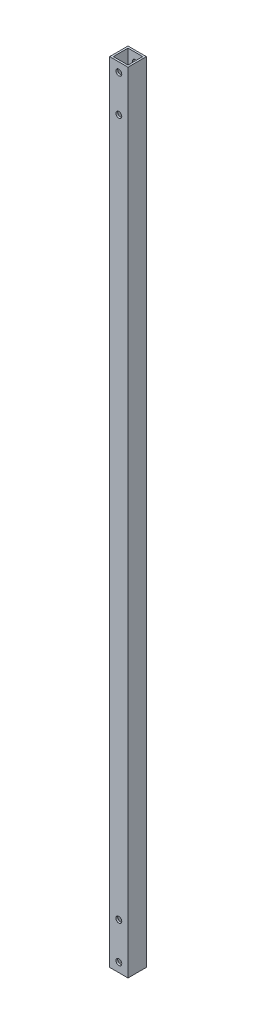
from build123d import *

# Parameters (mm, degrees)
SKETCH_1_W          = 10
SKETCH_1_H          = 10
SKETCH_1_W_2        = 8
SKETCH_1_H_2        = 8
EXTRUDE_1_DEPTH     = 214.97
SKETCH_2_R          = 1.6
CUT_EXTRUDE_1_DEPTH = 213.715


with BuildPart() as part:
    # ｽｹｯﾁ1 → ﾎﾞｽ - 押し出し1 (new, symmetric)
    with BuildSketch(Plane(origin=(0, 0, 0), x_dir=(1, 0, 0), z_dir=(0, 1, 0))):
        Rectangle(SKETCH_1_W, SKETCH_1_H)
        Rectangle(SKETCH_1_W_2, SKETCH_1_H_2, mode=Mode.SUBTRACT)
    extrude(amount=EXTRUDE_1_DEPTH, both=True)

    # ｽｹｯﾁ2 → ｶｯﾄ - 押し出し1 (cut, symmetric)
    with BuildSketch(Plane.XY.offset(5)):
        with Locations((0, 209.97)):
            Circle(SKETCH_2_R)
        with Locations((0, 189.97)):
            Circle(SKETCH_2_R)
    cut_extrude_1 = extrude(amount=CUT_EXTRUDE_1_DEPTH, both=True, mode=Mode.SUBTRACT)

    # ﾐﾗｰ1: ｶｯﾄ - 押し出し1 across plane
    add(cut_extrude_1.mirror(Plane.ZX), mode=Mode.SUBTRACT)


solid = part.part
